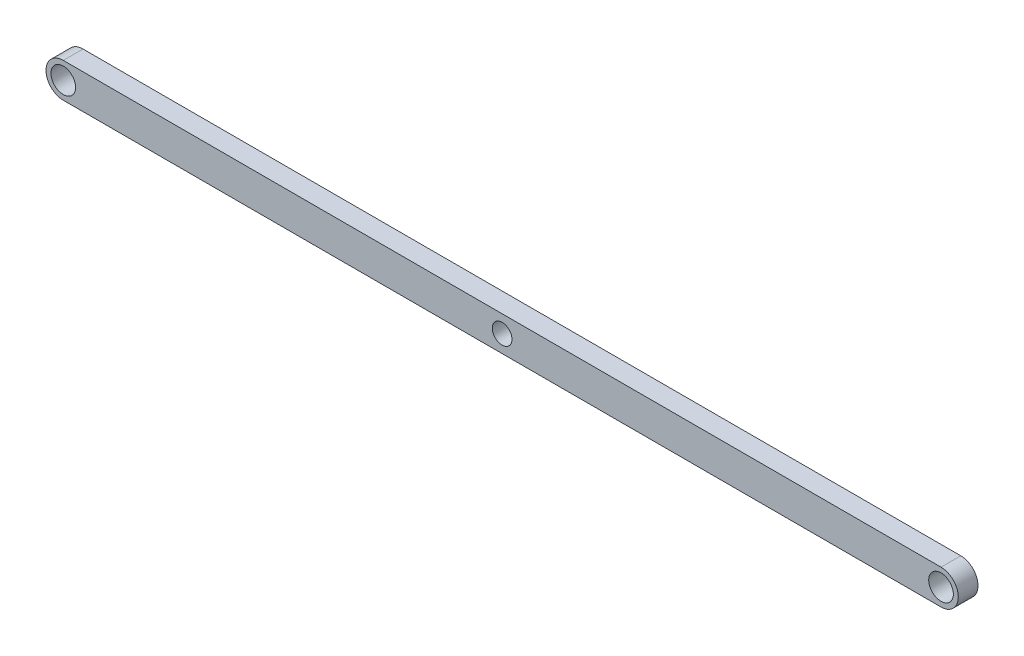
from build123d import *

# Parameters (mm, degrees)
SKETCH_1_R      = 2.5
SKETCH_1_R_2    = 2
EXTRUDE_1_DEPTH = 4


with BuildPart() as part:
    # 스케치1 → 보스-돌출1 (new body)
    with BuildSketch(Plane.XY):
        with BuildLine():
            Line((-92.261550106, 23.229064941), (85.738449894, 23.229064941))
            ThreePointArc((85.738449894, 23.229064941), (89.238449894, 19.729064941), (85.738449894, 16.229064941))
            Line((85.738449894, 16.229064941), (-92.261550106, 16.229064941))
            ThreePointArc((-92.261550106, 16.229064941), (-95.761550106, 19.729064941), (-92.261550106, 23.229064941))
        make_face()
        with Locations((-92.261550106, 19.729064941)):
            Circle(SKETCH_1_R, mode=Mode.SUBTRACT)
        with Locations((85.738449894, 19.729064941)):
            Circle(SKETCH_1_R, mode=Mode.SUBTRACT)
        with Locations((-3.261550106, 19.729064941)):
            Circle(SKETCH_1_R_2, mode=Mode.SUBTRACT)
    extrude(amount=EXTRUDE_1_DEPTH)


solid = part.part
